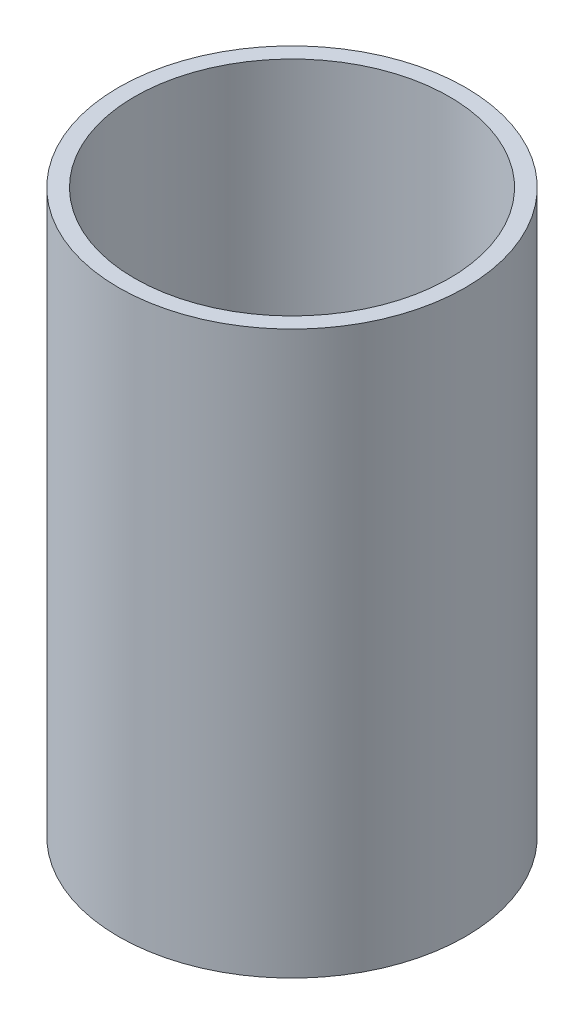
from build123d import *

# Parameters (mm, degrees)
SKETCH1_R            = 10.8
SKETCH1_R_2          = 9.8
BOSS_EXTRUDE7_DEPTH  = 35
SKETCH1_10_R         = 9.8
BOSS_EXTRUDE8_DEPTH  = 1
BOSS_EXTRUDE9_DEPTH  = 5
SKETCH1_13_W         = 2.9
SKETCH1_13_H         = 0.75
BOSS_EXTRUDE10_DEPTH = 2
SKETCH1_14_W         = 4.15
SKETCH1_14_H         = 2.25
BOSS_EXTRUDE11_DEPTH = 0.5
BOSS_EXTRUDE12_DEPTH = 20


with BuildPart() as part:
    # Sketch1 → Boss-Extrude7 (new body)
    with BuildSketch(Plane(origin=(0, 0, 0), x_dir=(1, 0, 0), z_dir=(0, 1, 0))):
        Circle(SKETCH1_R)
        Circle(SKETCH1_R_2, mode=Mode.SUBTRACT)
    extrude(amount=BOSS_EXTRUDE7_DEPTH)

    # Sketch1<10> → Boss-Extrude8 (add)
    with BuildSketch(Plane(origin=(0, 0, 0), x_dir=(1, 0, 0), z_dir=(0, 1, 0))):
        Circle(SKETCH1_10_R)
        Polygon((-2.35, 0), (-5.25, 0), (-7.25, 0), (-7.25, 3.75), (-5.25, 3.75), (5.25, 3.75), (7.25, 3.75), (7.25, 0), (5.25, 0), (2.35, 0), (2.35, -1), (-2.35, -1), align=None, mode=Mode.SUBTRACT)
    extrude(amount=BOSS_EXTRUDE8_DEPTH)

    # Sketch1<12> → Boss-Extrude9 (add)
    with BuildSketch(Plane(origin=(0, 0, 0), x_dir=(1, 0, 0), z_dir=(0, 1, 0))):
        Polygon((-5.25, 0), (-5.25, 0.75), (-6.5, 0.75), (-6.5, 3), (6.5, 3), (6.5, 0.75), (5.25, 0.75), (5.25, 0), (7.25, 0), (7.25, 3.75), (-7.25, 3.75), (-7.25, 0), align=None)
    extrude(amount=BOSS_EXTRUDE9_DEPTH)

    # Sketch1<13> → Boss-Extrude10 (add)
    with BuildSketch(Plane(origin=(0, 0, 0), x_dir=(1, 0, 0), z_dir=(0, 1, 0))):
        with Locations((-3.8, 0.375)):
            Rectangle(SKETCH1_13_W, SKETCH1_13_H)
        with Locations((3.8, 0.375)):
            Rectangle(SKETCH1_13_W, SKETCH1_13_H)
    extrude(amount=BOSS_EXTRUDE10_DEPTH)

    # Sketch1<14> → Boss-Extrude11 (add)
    with BuildSketch(Plane(origin=(0, 0, 0), x_dir=(1, 0, 0), z_dir=(0, 1, 0))):
        with Locations((-4.425, 1.875)):
            Rectangle(SKETCH1_14_W, SKETCH1_14_H)
        with Locations((4.425, 1.875)):
            Rectangle(SKETCH1_14_W, SKETCH1_14_H)
    extrude(amount=BOSS_EXTRUDE11_DEPTH)

    # Sketch1<15> → Boss-Extrude12 (add)
    with BuildSketch(Plane(origin=(0, 0, 0), x_dir=(1, 0, 0), z_dir=(0, 1, 0))):
        Polygon((-5.25, 0), (-5.25, 0.75), (-6.5, 0.75), (-6.5, 3), (-5.25, 3), (-5.25, 3.75), (-7.25, 3.75), (-7.25, 0), align=None)
        Polygon((5.25, 3.75), (5.25, 3), (6.5, 3), (6.5, 0.75), (5.25, 0.75), (5.25, 0), (7.25, 0), (7.25, 3.75), align=None)
    extrude(amount=BOSS_EXTRUDE12_DEPTH)


solid = part.part
